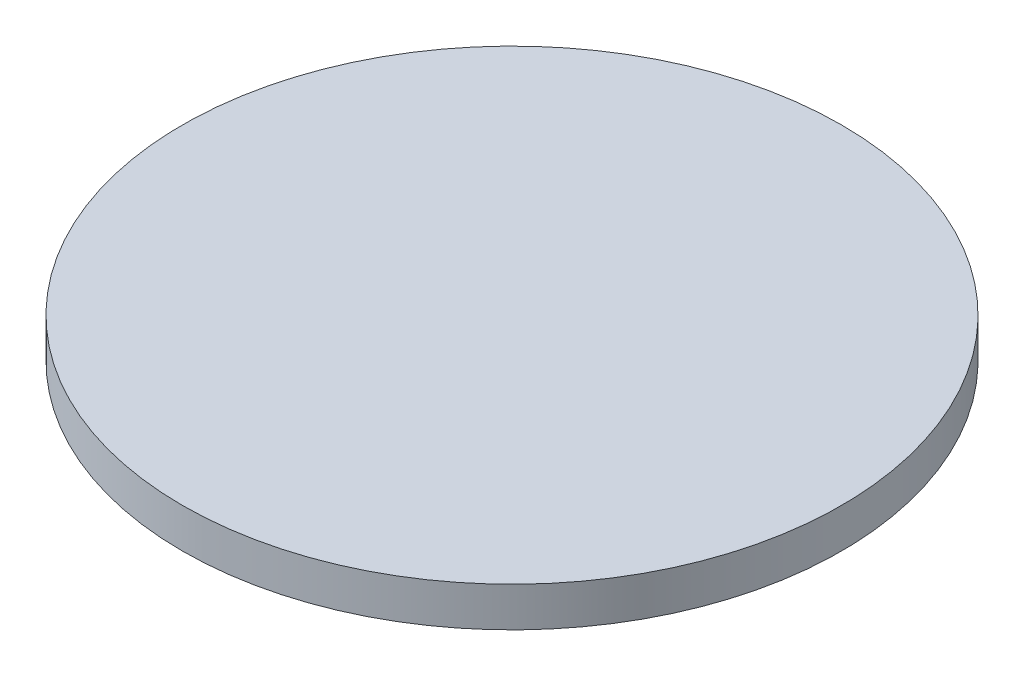
from build123d import *

# Parameters (mm, degrees)
SKETCH1_R           = 25
BOSS_EXTRUDE1_DEPTH = 3


with BuildPart() as part:
    # Sketch1 → Boss-Extrude1 (new body)
    with BuildSketch(Plane(origin=(0, 0, 0), x_dir=(1, 0, 0), z_dir=(0, 1, 0))):
        with Locations(Location((-14.212913293, 2.748723797, 0), (0, 0, 270))):
            Circle(SKETCH1_R)
    extrude(amount=BOSS_EXTRUDE1_DEPTH)


solid = part.part
